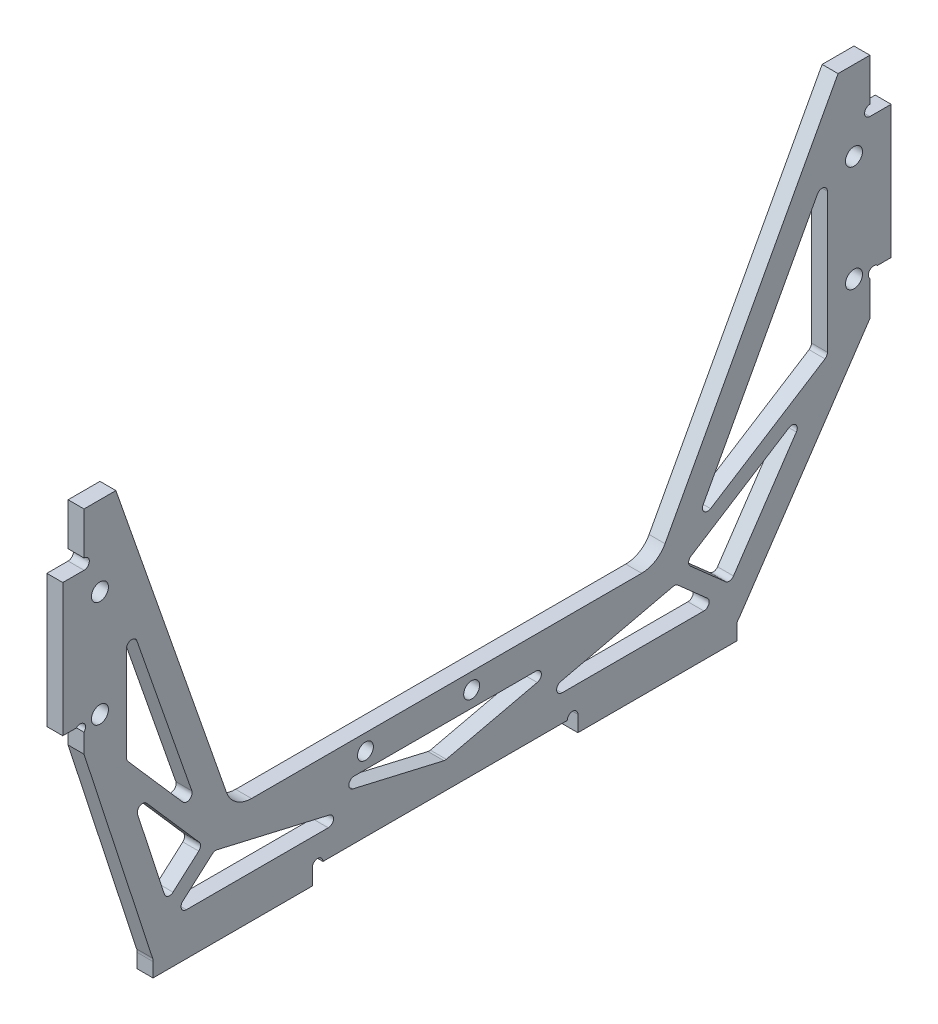
from build123d import *

# Parameters (mm, degrees)
EXTRUDE_1_DEPTH     = 3
SKETCH_2_W          = 4
SKETCH_2_H          = 25
EXTRUDE_2_DEPTH     = 3
SKETCH_6_R          = 1.6
CUT_EXTRUDE_4_DEPTH = 4
CUT_EXTRUDE_5_DEPTH = 10
CUT_EXTRUDE_7_DEPTH = 10
FILLET_1_R          = 5
SKETCH_11_R         = 1.5
CUT_EXTRUDE_8_DEPTH = 90.117899437


with BuildPart() as part:
    # 草图1 → 凸台-拉伸1 (new body)
    with BuildSketch(Plane(origin=(0, 0, 0), x_dir=(0, 0, -1), z_dir=(1, 0, 0))):
        Polygon((-46, -23), (-68, 40), (-74, 40), (-74, -20.726707409), (-61, -40), (-61, -43), (-31, -43), (-31, -40), (19, -40), (19, -43), (49, -43), (49, -40), (74, -2.935975787), (74, 40), (68, 40), (34, -23), align=None)
    extrude(amount=EXTRUDE_1_DEPTH)

    # 草图2 → 凸台-拉伸2 (add)
    with BuildSketch(Plane(origin=(3, 0, 0), x_dir=(0, 0, -1), z_dir=(1, 0, 0))):
        with Locations((-76, 17.5)):
            Rectangle(SKETCH_2_W, SKETCH_2_H)
        with Locations((76, 17.5)):
            Rectangle(SKETCH_2_W, SKETCH_2_H)
    extrude(amount=-EXTRUDE_2_DEPTH)

    # 草图6 → 切除-拉伸4 (cut)
    with BuildSketch(Plane.ZY):
        with Locations((-71, 5)):
            Circle(SKETCH_6_R)
        with Locations((71, 25)):
            Circle(SKETCH_6_R)
        with Locations((71, 5)):
            Circle(SKETCH_6_R)
        with Locations((-71, 25)):
            Circle(SKETCH_6_R)
    extrude(amount=-CUT_EXTRUDE_4_DEPTH, mode=Mode.SUBTRACT)

    # 草图7 → 切除-拉伸5 (cut)
    with BuildSketch(Plane(origin=(3, 0, 0), x_dir=(0, 0, -1), z_dir=(1, 0, 0))):
        with BuildLine():
            Line((-66, 13.209781141), (-66, -4.624153975))
            ThreePointArc((-66, -4.624153975), (-65.936068557, -4.975971621), (-65.752448687, -5.282804848))
            Line((-65.752448687, -5.282804848), (-55.391275304, -17.119502604))
            ThreePointArc((-55.391275304, -17.119502604), (-54.135455337, -17.324921956), (-53.694734868, -16.131168898))
            Line((-53.694734868, -16.131168898), (-64.055908251, 13.539463974))
            ThreePointArc((-64.055908251, 13.539463974), (-65.167194873, 14.195705009), (-66, 13.209781141))
        make_face()
        with BuildLine():
            Line((66, -4.449930151), (66, 21.807804944))
            ThreePointArc((66, 21.807804944), (65.244926343, 22.777346633), (64.119977827, 22.282737545))
            Line((64.119977827, 22.282737545), (42.579599238, -17.630316899))
            ThreePointArc((42.579599238, -17.630316899), (42.777733508, -18.836706189), (43.995039468, -18.94983668))
            Line((43.995039468, -18.94983668), (65.535418057, -5.29451733))
            ThreePointArc((65.535418057, -5.29451733), (65.876190064, -4.931895887), (66, -4.449930151))
        make_face()
        Polygon((-74, 0), (-61, -40), (-74, -20.726707409), align=None)
        with BuildLine():
            Line((-62.213350607, -13.880667443), (-52.307335811, -25.197387929))
            ThreePointArc((-52.307335811, -25.197387929), (-52.061835208, -25.920048281), (-52.39764858, -26.605422566))
            Line((-52.39764858, -26.605422566), (-57.236264859, -30.880697516))
            ThreePointArc((-57.236264859, -30.880697516), (-58.161708676, -31.096025601), (-58.849434846, -30.440399824))
            Line((-58.849434846, -30.440399824), (-63.916833363, -14.848404388))
            ThreePointArc((-63.916833363, -14.848404388), (-63.459750443, -13.669828659), (-62.213350607, -13.880667443))
        make_face()
        with BuildLine():
            Line((-55.387669494, -33.250616236), (-49.831358953, -28.341205383))
            ThreePointArc((-49.831358953, -28.341205383), (-49.414538234, -28.121145774), (-48.943216882, -28.116463272))
            Line((-48.943216882, -28.116463272), (-27.782801194, -33.025874126))
            ThreePointArc((-27.782801194, -33.025874126), (-27.015296935, -34.11374121), (-28.008807346, -35))
            Line((-28.008807346, -35), (-54.725533576, -35))
            ThreePointArc((-54.725533576, -35), (-55.660783212, -34.353988867), (-55.387669494, -33.250616236))
        make_face()
        with BuildLine():
            Line((-23.126212383, -29), (11.126212383, -29))
            ThreePointArc((11.126212383, -29), (12.119722794, -29.88625879), (11.352218536, -30.974125874))
            Line((11.352218536, -30.974125874), (-5.773993847, -34.947564496))
            ThreePointArc((-5.773993847, -34.947564496), (-6, -34.973438622), (-6.226006153, -34.947564496))
            Line((-6.226006153, -34.947564496), (-23.352218536, -30.974125874))
            ThreePointArc((-23.352218536, -30.974125874), (-24.119722794, -29.88625879), (-23.126212383, -29))
        make_face()
        with BuildLine():
            Line((15.782801194, -33.025874126), (36.943216882, -28.116463272))
            ThreePointArc((36.943216882, -28.116463272), (37.414538234, -28.121145774), (37.831358953, -28.341205383))
            Line((37.831358953, -28.341205383), (43.387669494, -33.250616236))
            ThreePointArc((43.387669494, -33.250616236), (43.660783212, -34.353988867), (42.725533576, -35))
            Line((42.725533576, -35), (16.008807346, -35))
            ThreePointArc((16.008807346, -35), (15.015296935, -34.11374121), (15.782801194, -33.025874126))
        make_face()
        with BuildLine():
            Line((40.32049134, -24.831312908), (58.783941471, -13.126583263))
            ThreePointArc((58.783941471, -13.126583263), (60.036438838, -13.274178861), (60.148397101, -14.530363346))
            Line((60.148397101, -14.530363346), (48.30691143, -32.086087811))
            ThreePointArc((48.30691143, -32.086087811), (47.604393348, -32.518859029), (46.815737939, -32.276278671))
            Line((46.815737939, -32.276278671), (40.193773479, -26.425283852))
            ThreePointArc((40.193773479, -26.425283852), (39.859054482, -25.596651891), (40.32049134, -24.831312908))
        make_face()
    extrude(amount=-CUT_EXTRUDE_5_DEPTH, mode=Mode.SUBTRACT)

    # 草图10 → 切除-拉伸7 (cut)
    with BuildSketch(Plane.ZY):
        with BuildLine():
            Line((61.096725602, -39.702382762), (61, -40.312940669))
            ThreePointArc((61, -40.312940669), (61, -40), (61.096725602, -39.702382762))
        make_face()
        with BuildLine():
            Line((-74, 30), (-74, 32))
            ThreePointArc((-74, 32), (-73, 31), (-74, 30))
        make_face()
        with BuildLine():
            Line((74, 30), (74, 32))
            ThreePointArc((74, 32), (73, 31), (74, 30))
        make_face()
        with BuildLine():
            Line((-74, 3.585786438), (-75.414213562, 5))
            ThreePointArc((-75.414213562, 5), (-74, 5), (-74, 3.585786438))
        make_face()
        with BuildLine():
            Line((74, 3.585786438), (75.414213562, 5))
            ThreePointArc((75.414213562, 5), (74, 5), (74, 3.585786438))
        make_face()
        with BuildLine():
            Line((-17, -40), (-19, -40))
            ThreePointArc((-19, -40), (-18, -39), (-17, -40))
        make_face()
        with BuildLine():
            Line((29, -40), (31, -40))
            ThreePointArc((31, -40), (30, -39), (29, -40))
        make_face()
        with BuildLine():
            Line((-49.326984365, -39.515225743), (-49, -40.584743409))
            ThreePointArc((-49, -40.584743409), (-49, -40), (-49.326984365, -39.515225743))
        make_face()
    extrude(amount=-CUT_EXTRUDE_7_DEPTH, mode=Mode.SUBTRACT)

    # 圆角1
    fillet_1_edges = [part.edges().sort_by_distance(p)[0] for p in [
        (1.5, -23, 46),
        (1.5, -23, -34),
    ]]
    fillet(fillet_1_edges, radius=FILLET_1_R)

    # 草图11 → 切除-拉伸8 (cut, through all)
    with BuildSketch(Plane(origin=(3, 0, 0), x_dir=(0, 0, -1), z_dir=(1, 0, 0))):
        with Locations((-1, -26)):
            Circle(SKETCH_11_R)
        with Locations((-21, -26)):
            Circle(SKETCH_11_R)
    extrude(amount=-CUT_EXTRUDE_8_DEPTH, mode=Mode.SUBTRACT)


solid = part.part
